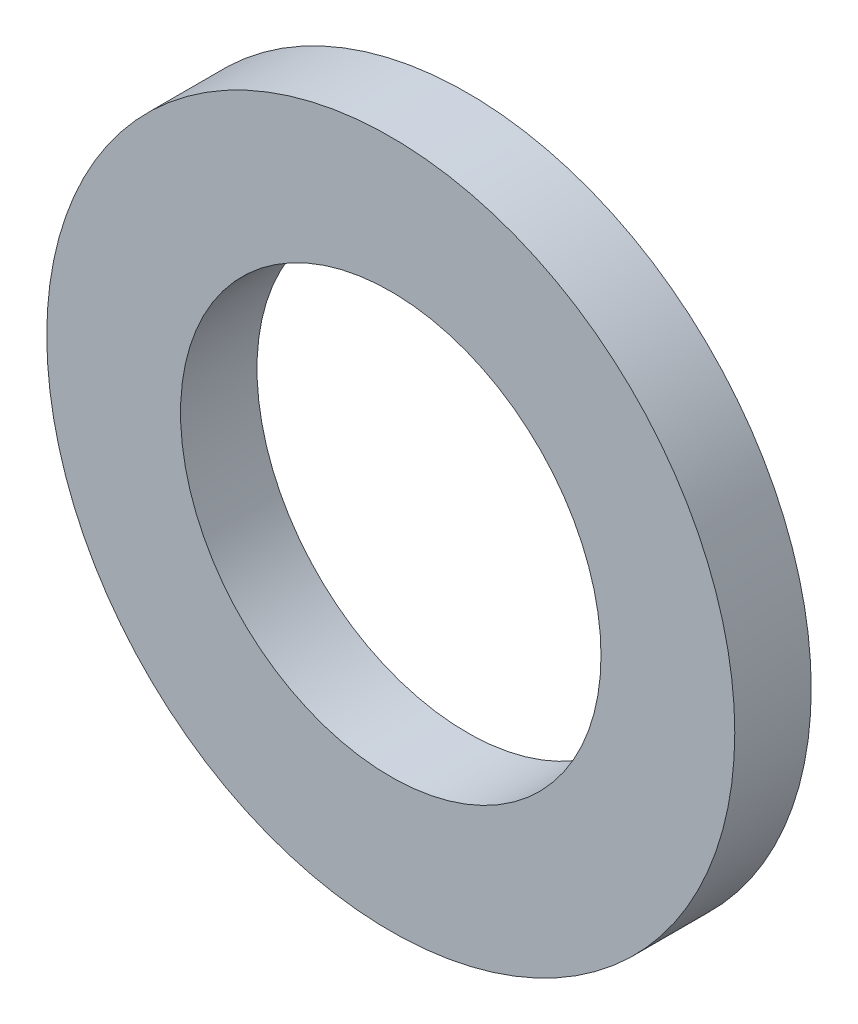
from build123d import *

# Parameters (mm, degrees)
CROQUIS1_R              = 4.5
CROQUIS1_R_2            = 2.75
SALIENTE_EXTRUIR1_DEPTH = 1


with BuildPart() as part:
    # Croquis1 → Saliente-Extruir1 (new body)
    with BuildSketch(Plane.XY):
        Circle(CROQUIS1_R)
        Circle(CROQUIS1_R_2, mode=Mode.SUBTRACT)
    extrude(amount=-SALIENTE_EXTRUIR1_DEPTH)


solid = part.part
